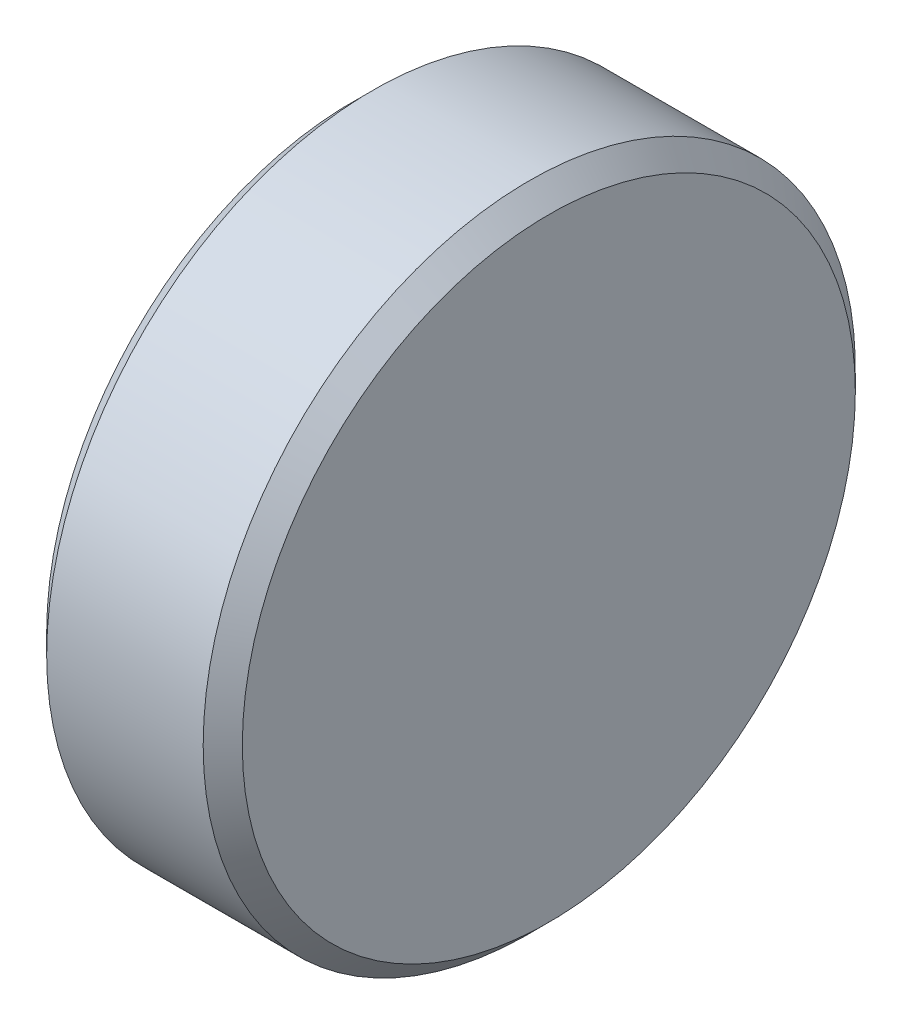
from build123d import *

# Parameters (mm, degrees)
SKETCH1_R           = 31.75
BOSS_EXTRUDE1_DEPTH = 19.05
SKETCH2_R           = 2.9845
CUT_EXTRUDE1_DEPTH  = 12.7
CHAMFER1_SIZE       = 1.905


with BuildPart() as part:
    # Sketch1 → Boss-Extrude1 (new body)
    with BuildSketch(Plane(origin=(0, 0, 0), x_dir=(0, 0, -1), z_dir=(1, 0, 0))):
        with Locations(Location((0, 0, 0), (0, 0, 180))):
            Circle(SKETCH1_R)
    extrude(amount=BOSS_EXTRUDE1_DEPTH)

    # Sketch2 → Cut-Extrude1 (cut)
    with BuildSketch(Plane.ZY):
        Circle(SKETCH2_R)
    extrude(amount=-CUT_EXTRUDE1_DEPTH, mode=Mode.SUBTRACT)

    # Chamfer1
    chamfer1_edges = [part.edges().sort_by_distance(p)[0] for p in [
        (0, 0, -31.75),
        (19.05, 0, -31.75),
    ]]
    chamfer(chamfer1_edges, length=CHAMFER1_SIZE)


solid = part.part
